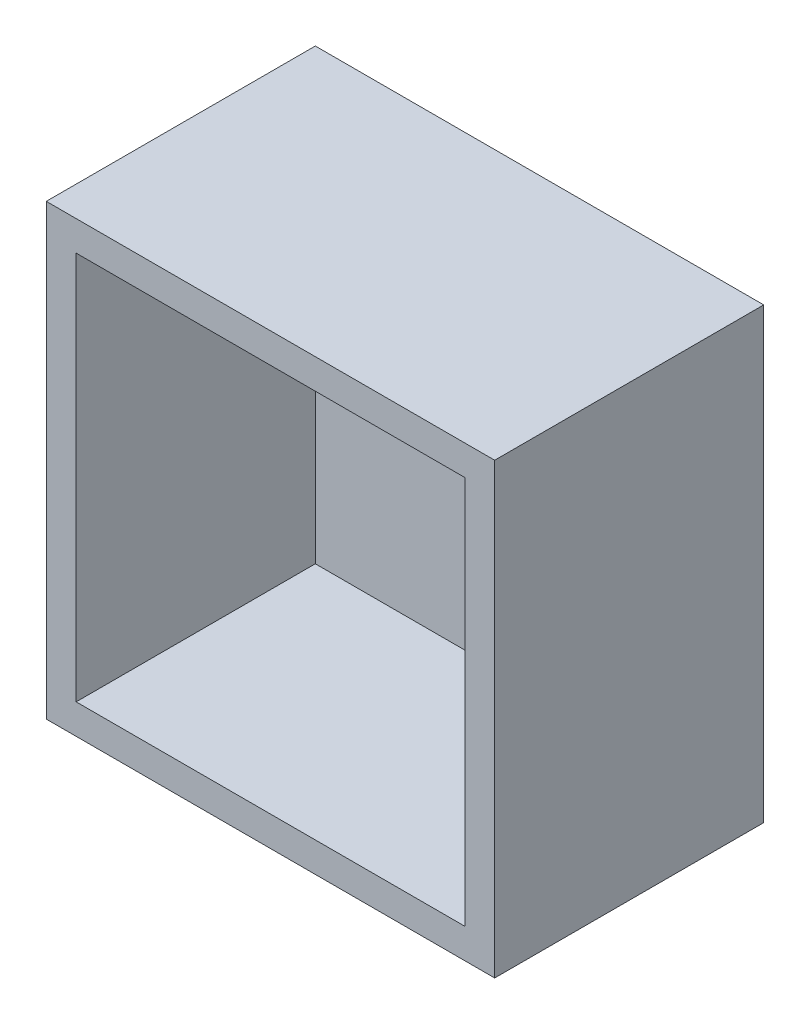
from build123d import *

# Parameters (mm, degrees)
SKETCH2_W           = 75
SKETCH2_H           = 75
BOSS_EXTRUDE1_DEPTH = 45
SHELL1_T            = -5


with BuildPart() as part:
    # Sketch2 → Boss-Extrude1 (new body)
    with BuildSketch(Plane.XY):
        Rectangle(SKETCH2_W, SKETCH2_H)
    extrude(amount=BOSS_EXTRUDE1_DEPTH)

    # Shell1
    shell1_openings = [part.faces().sort_by_distance(p)[0] for p in [
        (0, 0, 45),
    ]]
    offset(amount=SHELL1_T, openings=shell1_openings, kind=Kind.INTERSECTION)


solid = part.part
